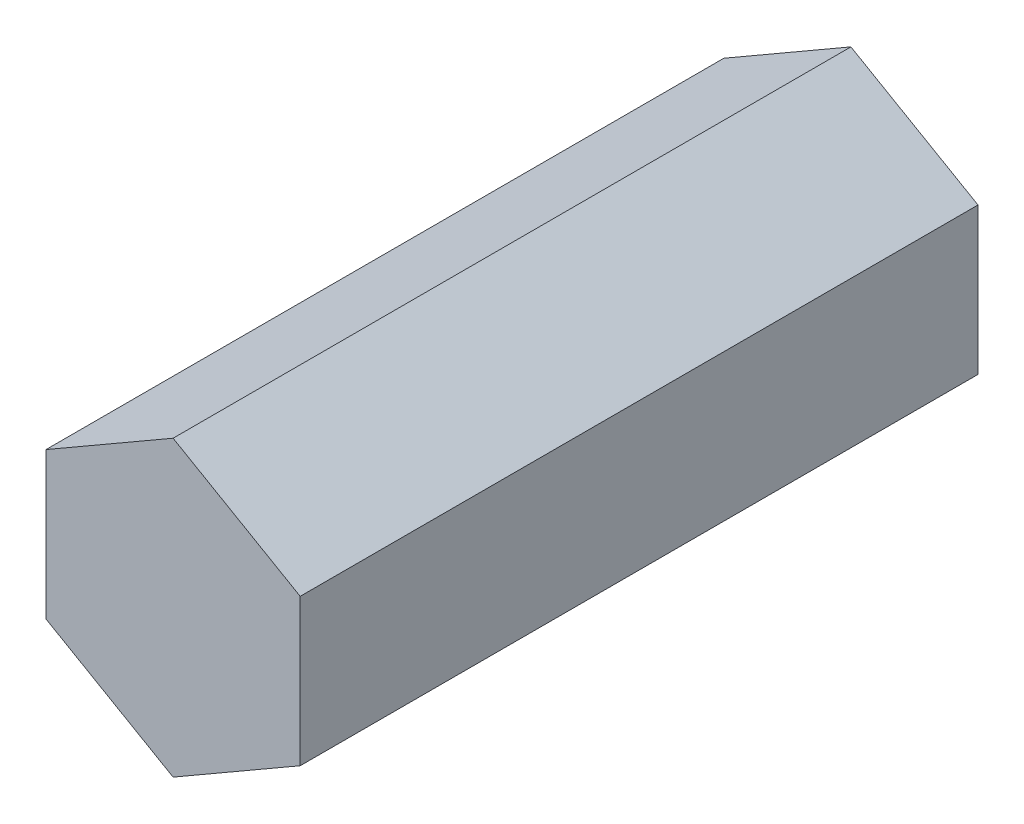
from build123d import *

# Parameters (mm, degrees)
EXTRUDE_1_DEPTH = 8


with BuildPart() as part:
    # 草图2 → 凸台-拉伸1 (new body)
    with BuildSketch(Plane.XY):
        Polygon((0, 1.732050808), (-1.5, 0.866025404), (-1.5, -0.866025404), (0, -1.732050808), (1.5, -0.866025404), (1.5, 0.866025404), align=None)
    extrude(amount=EXTRUDE_1_DEPTH)


solid = part.part
